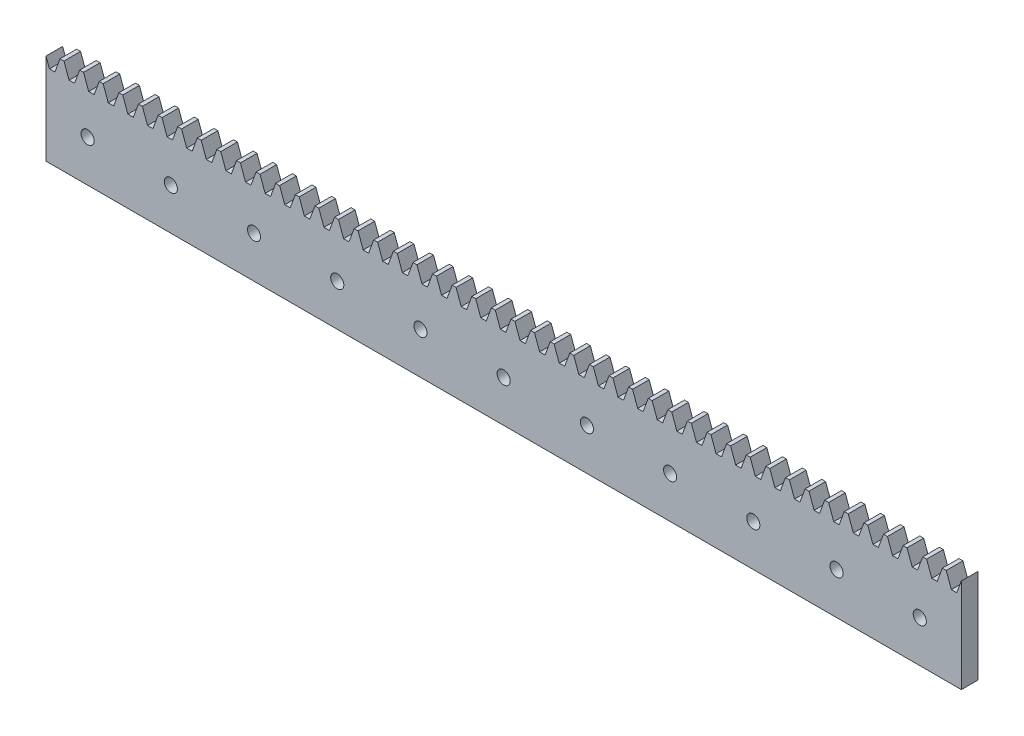
from build123d import *

# Parameters (mm, degrees)
BLANKSKE_W          = 660
BLANKSKE_H          = 23
BLANK_DEPTH         = 4
TOOTHCUTSIM_DEPTH   = 661.412749726
TEETHCUTS_COUNT     = 141
TEETHCUTS_PITCH     = 4.712388975
SKETCH_2_R          = 1.575
CUT_EXTRUDE_2_DEPTH = 661.412749726
SKETCH_3_W          = 220
SKETCH_3_H          = 92.024953344
SKETCH_3_H_2        = 80.466347601
CUT_EXTRUDE_3_DEPTH = 661.412749726


with BuildPart() as part:
    # BlankSke → Blank (new body)
    with BuildSketch(Plane.XY):
        with Locations((330, 11.5)):
            Rectangle(BLANKSKE_W, BLANKSKE_H)
    extrude(amount=-BLANK_DEPTH)

    # TooCutSkeSim → ToothCutSim (cut, through all)
    with BuildSketch(Plane.XY):
        Polygon((0.654653055, 19.625), (-0.654653055, 19.625), (-1.892297439, 23.0254), (1.892297439, 23.0254), align=None)
    toothcutsim = extrude(amount=-TOOTHCUTSIM_DEPTH, mode=Mode.SUBTRACT)

    # TeethCuts: ToothCutSim ×141
    with Locations(*[(i * TEETHCUTS_PITCH, 0, 0) for i in range(1, TEETHCUTS_COUNT)]):
        add(toothcutsim, mode=Mode.SUBTRACT)

    # 草图2 → 切除-拉伸2 (cut, through all)
    with BuildSketch(Plane.XY):
        with Locations((650, 10)):
            Circle(SKETCH_2_R)
        with Locations((630, 10)):
            Circle(SKETCH_2_R)
        with Locations((610, 10)):
            Circle(SKETCH_2_R)
        with Locations((590, 10)):
            Circle(SKETCH_2_R)
        with Locations((570, 10)):
            Circle(SKETCH_2_R)
        with Locations((550, 10)):
            Circle(SKETCH_2_R)
        with Locations((530, 10)):
            Circle(SKETCH_2_R)
        with Locations((510, 10)):
            Circle(SKETCH_2_R)
        with Locations((490, 10)):
            Circle(SKETCH_2_R)
        with Locations((470, 10)):
            Circle(SKETCH_2_R)
        with Locations((450, 10)):
            Circle(SKETCH_2_R)
        with Locations((430, 10)):
            Circle(SKETCH_2_R)
        with Locations((410, 10)):
            Circle(SKETCH_2_R)
        with Locations((390, 10)):
            Circle(SKETCH_2_R)
        with Locations((370, 10)):
            Circle(SKETCH_2_R)
        with Locations((350, 10)):
            Circle(SKETCH_2_R)
        with Locations((330, 10)):
            Circle(SKETCH_2_R)
        with Locations((310, 10)):
            Circle(SKETCH_2_R)
        with Locations((290, 10)):
            Circle(SKETCH_2_R)
        with Locations((270, 10)):
            Circle(SKETCH_2_R)
        with Locations((250, 10)):
            Circle(SKETCH_2_R)
        with Locations((230, 10)):
            Circle(SKETCH_2_R)
        with Locations((210, 10)):
            Circle(SKETCH_2_R)
        with Locations((190, 10)):
            Circle(SKETCH_2_R)
        with Locations((170, 10)):
            Circle(SKETCH_2_R)
        with Locations((150, 10)):
            Circle(SKETCH_2_R)
        with Locations((130, 10)):
            Circle(SKETCH_2_R)
        with Locations((110, 10)):
            Circle(SKETCH_2_R)
        with Locations((90, 10)):
            Circle(SKETCH_2_R)
        with Locations((70, 10)):
            Circle(SKETCH_2_R)
        with Locations((50, 10)):
            Circle(SKETCH_2_R)
        with Locations((30, 10)):
            Circle(SKETCH_2_R)
        with Locations((10, 10)):
            Circle(SKETCH_2_R)
    extrude(amount=-CUT_EXTRUDE_2_DEPTH, mode=Mode.SUBTRACT)

    # 草图3 → 切除-拉伸3 (cut, through all)
    with BuildSketch(Plane.XY):
        with Locations((110, 46.012476672)):
            Rectangle(SKETCH_3_W, SKETCH_3_H)
        with Locations((550, 40.233173801)):
            Rectangle(SKETCH_3_W, SKETCH_3_H_2)
    extrude(amount=-CUT_EXTRUDE_3_DEPTH, mode=Mode.SUBTRACT)


solid = part.part
